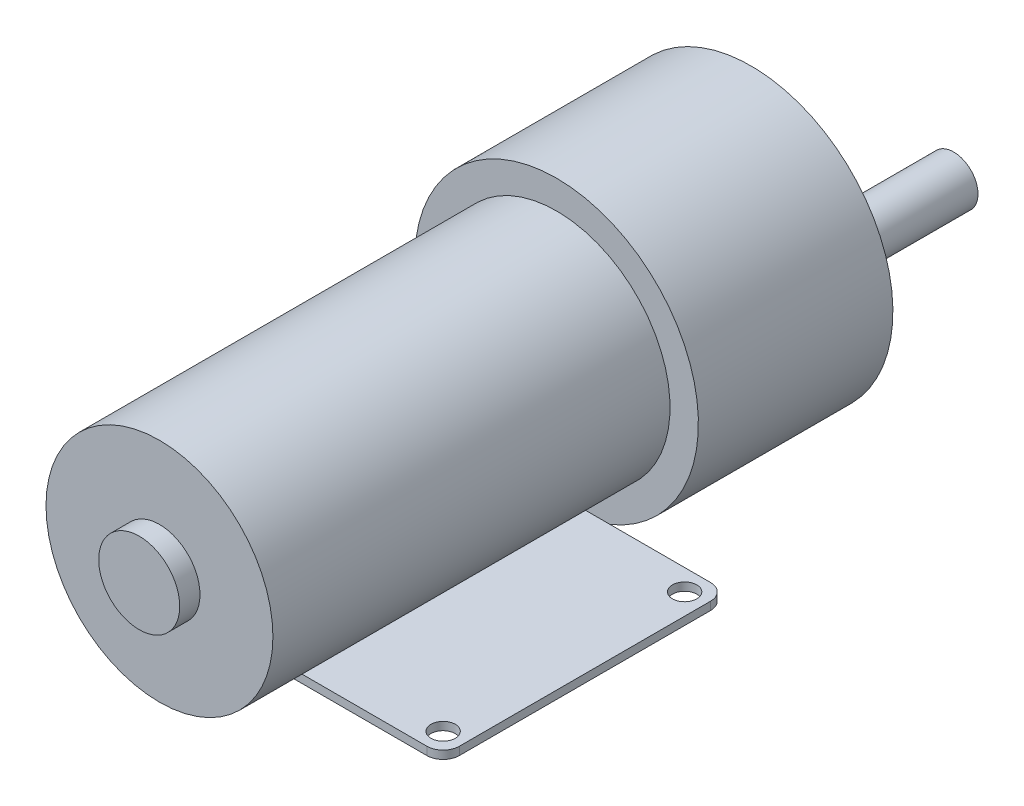
from build123d import *

# Parameters (mm, degrees)
ESQUISSE1_R             = 14
BOSS_EXTRU_1_DEPTH      = 49
ESQUISSE2_R             = 5
BOSS_EXTRU_2_DEPTH      = 2.5
ESQUISSE3_R             = 17.5
BOSS_EXTRU_3_DEPTH      = 24
ESQUISSE4_R             = 6
BOSS_EXTRU_4_DEPTH      = 10
ESQUISSE5_R             = 3
BOSS_EXTRU_5_DEPTH      = 15
ESQUISSE7_OUTSIDE_W     = 59.406
ESQUISSE7_OUTSIDE_H     = 59.406
ENL_V_MAT_EXTRU_1_DEPTH = 12
BOSS_EXTRU_6_DEPTH      = 35
CONG_1_R                = 2
ESQUISSE9_R             = 1.5
ENL_V_MAT_EXTRU_2_DEPTH = 35


with BuildPart() as part:
    # Esquisse1 → Boss.-Extru.1 (new body)
    with BuildSketch(Plane.XY):
        with Locations((9.642437394, 0)):
            Circle(ESQUISSE1_R)
    extrude(amount=BOSS_EXTRU_1_DEPTH)

    # Esquisse2 → Boss.-Extru.2 (add)
    with BuildSketch(Plane.XY.offset(49)):
        with Locations((9.642437394, 0)):
            Circle(ESQUISSE2_R)
    extrude(amount=BOSS_EXTRU_2_DEPTH)

    # Esquisse3 → Boss.-Extru.3 (add)
    with BuildSketch(Plane(origin=(0, 0, 0), x_dir=(-1, 0, 0), z_dir=(0, 0, -1))):
        with Locations((-9.642437394, 0)):
            Circle(ESQUISSE3_R)
    extrude(amount=BOSS_EXTRU_3_DEPTH)

    # Esquisse4 → Boss.-Extru.4 (add)
    with BuildSketch(Plane(origin=(0, 0, -24), x_dir=(-1, 0, 0), z_dir=(0, 0, -1))):
        with Locations((-9.642437394, -7.2)):
            Circle(ESQUISSE4_R)
    extrude(amount=BOSS_EXTRU_4_DEPTH)

    # Esquisse5 → Boss.-Extru.5 (add)
    with BuildSketch(Plane(origin=(0, 0, -34), x_dir=(-1, 0, 0), z_dir=(0, 0, -1))):
        with Locations((-9.642437394, -7.2)):
            Circle(ESQUISSE5_R)
    extrude(amount=BOSS_EXTRU_5_DEPTH)

    # Esquisse7 outside → Enlèv. mat.-Extru.1 (cut)
    with BuildSketch(Plane(origin=(0, 0, -49), x_dir=(-1, 0, 0), z_dir=(0, 0, -1))):
        with Locations((-9.642, 0)):
            Rectangle(ESQUISSE7_OUTSIDE_W, ESQUISSE7_OUTSIDE_H)
        with BuildLine():
            Line((-11.300749789, -9.7), (-7.984124999, -9.7))
            ThreePointArc((-7.984124999, -9.7), (-9.642437394, -4.2), (-11.300749789, -9.7))
        make_face(mode=Mode.SUBTRACT)
    extrude(amount=-ENL_V_MAT_EXTRU_1_DEPTH, mode=Mode.SUBTRACT)

    # Esquisse8 → Boss.-Extru.6 (add)
    with BuildSketch(Plane.XY):
        Polygon((9.642437394, -16.204776279), (30.642437394, -16.204776279), (30.642437394, -17.204776279), (9.642437394, -17.204776279), (-11.357562606, -17.204776279), (-11.357562606, -16.204776279), align=None)
    extrude(amount=BOSS_EXTRU_6_DEPTH)

    # Congé1
    cong_1_edges = [part.edges().sort_by_distance(p)[0] for p in [
        (-11.357562606, -16.704776279, 0),
        (30.642437394, -16.704776279, 0),
        (-11.357562606, -16.704776279, 35),
        (30.642437394, -16.704776279, 35),
    ]]
    fillet(cong_1_edges, radius=CONG_1_R)

    # Esquisse9 → Enlèv. mat.-Extru.2 (cut)
    with BuildSketch(Plane.XZ.offset(17.204776279)):
        with Locations(Location((28.042437394, 32.4, 0), (0, 0, 270))):
            Circle(ESQUISSE9_R)
        with Locations(Location((-8.757562606, 32.4, 0), (0, 0, 270))):
            Circle(ESQUISSE9_R)
        with Locations(Location((-8.757562606, 2.6, 0), (0, 0, 270))):
            Circle(ESQUISSE9_R)
        with Locations(Location((28.042437394, 2.6, 0), (0, 0, 270))):
            Circle(ESQUISSE9_R)
    extrude(amount=-ENL_V_MAT_EXTRU_2_DEPTH, mode=Mode.SUBTRACT)


solid = part.part
